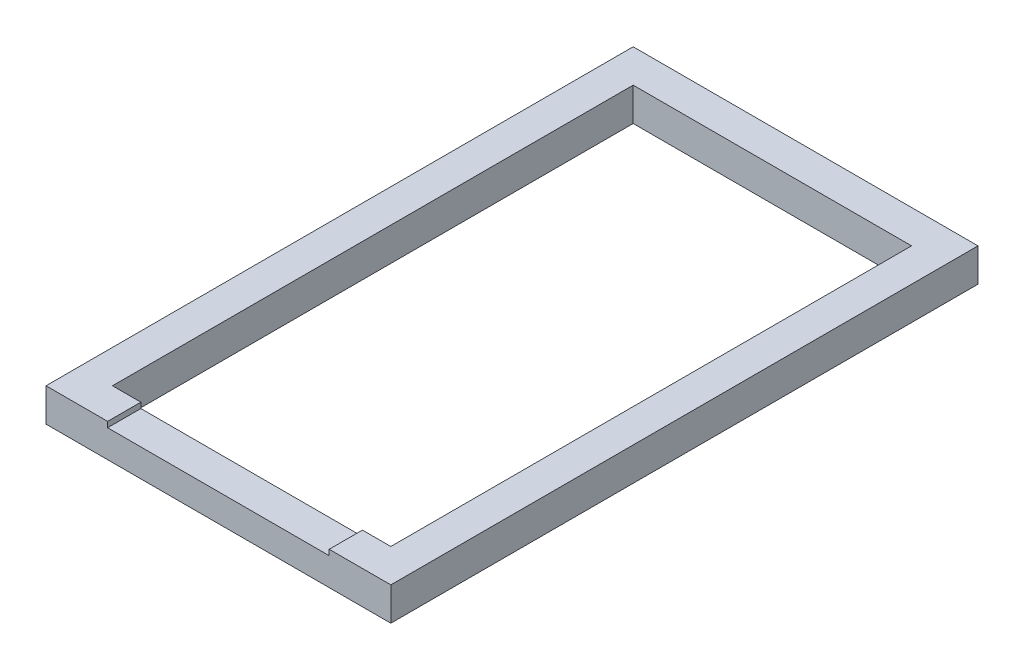
from build123d import *

# Parameters (mm, degrees)
SKETCH_1_W          = 6225
SKETCH_1_H          = 10600
SKETCH_1_W_2        = 5025
SKETCH_1_H_2        = 9400
EXTRUDE_1_DEPTH     = 600
SKETCH_2_W          = 4000
SKETCH_2_H          = 100
CUT_EXTRUDE_2_DEPTH = 600


with BuildPart() as part:
    # Эскиз1 → Бобышка-Вытянуть1 (new body)
    with BuildSketch(Plane(origin=(0, 0, 0), x_dir=(1, 0, 0), z_dir=(0, 1, 0))):
        Rectangle(SKETCH_1_W, SKETCH_1_H)
        Rectangle(SKETCH_1_W_2, SKETCH_1_H_2, mode=Mode.SUBTRACT)
    extrude(amount=-EXTRUDE_1_DEPTH)

    # Эскиз2 → Вырез-Вытянуть2 (cut)
    with BuildSketch(Plane.XY.offset(5300)):
        with Locations((0, -50)):
            Rectangle(SKETCH_2_W, SKETCH_2_H)
    extrude(amount=-CUT_EXTRUDE_2_DEPTH, mode=Mode.SUBTRACT)


solid = part.part
